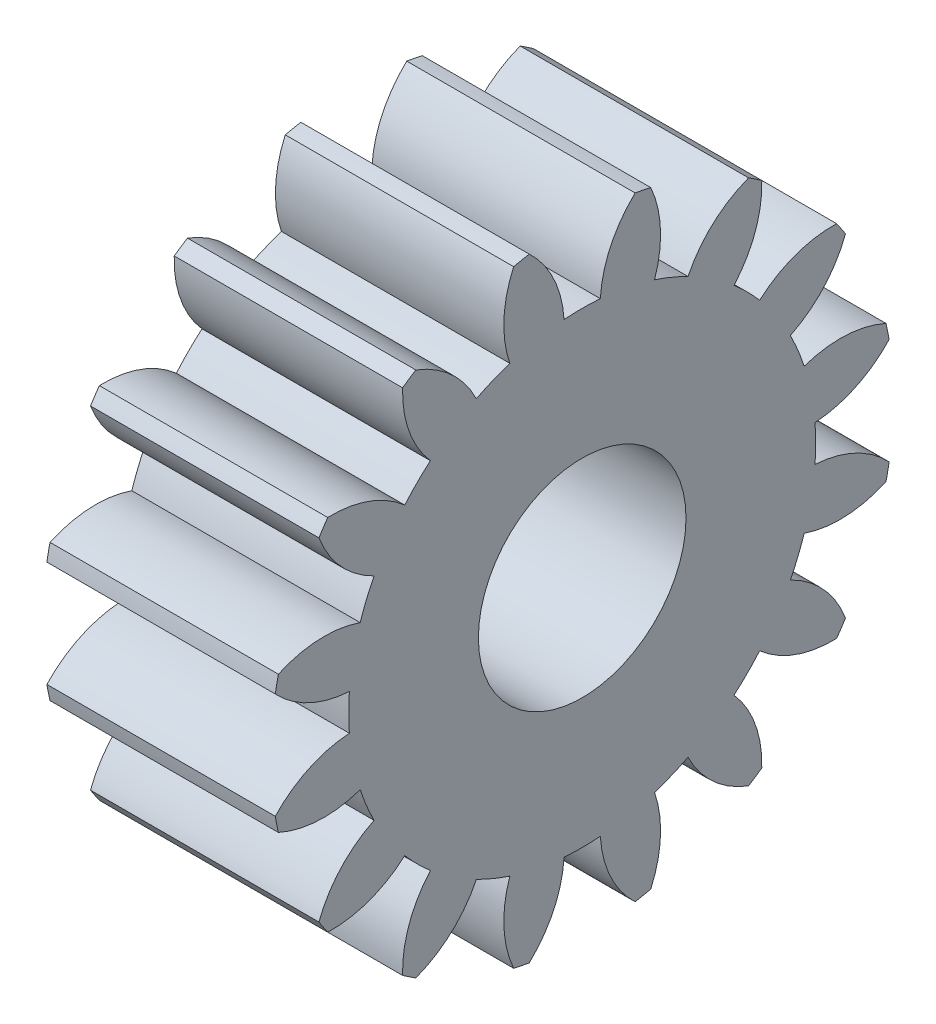
from build123d import *

# Parameters (mm, degrees)
BASPROSKE_W     = 3.3
BASPROSKE_H     = 4.5
TOOTHCUT_DEPTH  = 8.168681887
TEETHCUTS_COUNT = 16
TEETHCUTS_ANGLE = 337.5
BORSKE_R        = 1.5
BORE_DEPTH      = 50.0000508


with BuildPart() as part:
    # BasProSke → Base-Revolve (revolve)
    with BuildSketch(Plane(origin=(0, 0, 0), x_dir=(1, 0, 0), z_dir=(0, 1, 0)), mode=Mode.PRIVATE) as base_revolve_sk:
        with Locations((1.65, 2.25)):
            Rectangle(BASPROSKE_W, BASPROSKE_H)
    revolve(base_revolve_sk.sketch.rotate(Axis((-10, 0, 0), (1, 0, 0)), 180), axis=Axis((-10, 0, 0), (1, 0, 0)))

    # TooCutSke → ToothCut (cut, through all)
    with BuildSketch(Plane(origin=(0, 0, 0), x_dir=(0, 0, -1), z_dir=(1, 0, 0))):
        with BuildLine():
            ThreePointArc((0.261866103, 3.363822549), (0, 3.374), (-0.261866103, 3.363822549))
            ThreePointArc((-0.261866103, 3.363822549), (-0.417714668, 3.961827375), (-0.788562282, 4.456165918))
            ThreePointArc((-0.788562282, 4.456165918), (0, 4.5254), (0.788562282, 4.456165918))
            ThreePointArc((0.788562282, 4.456165918), (0.417714668, 3.961827375), (0.261866103, 3.363822549))
        make_face()
    toothcut = extrude(amount=TOOTHCUT_DEPTH, mode=Mode.SUBTRACT)

    # TeethCuts: ToothCut ×16 about axis
    teethcuts_axis = Axis((-10, 0, 0), (1, 0, 0))
    for i in range(1, TEETHCUTS_COUNT):
        add(toothcut.rotate(teethcuts_axis, i * TEETHCUTS_ANGLE / (TEETHCUTS_COUNT - 1)), mode=Mode.SUBTRACT)

    # BorSke → Bore (cut, symmetric)
    with BuildSketch(Plane(origin=(0, 0, 0), x_dir=(0, 0, -1), z_dir=(1, 0, 0))):
        with Locations(Location((0, 0, 0), (0, 0, 180))):
            Circle(BORSKE_R)
    extrude(amount=BORE_DEPTH, both=True, mode=Mode.SUBTRACT)


solid = part.part
